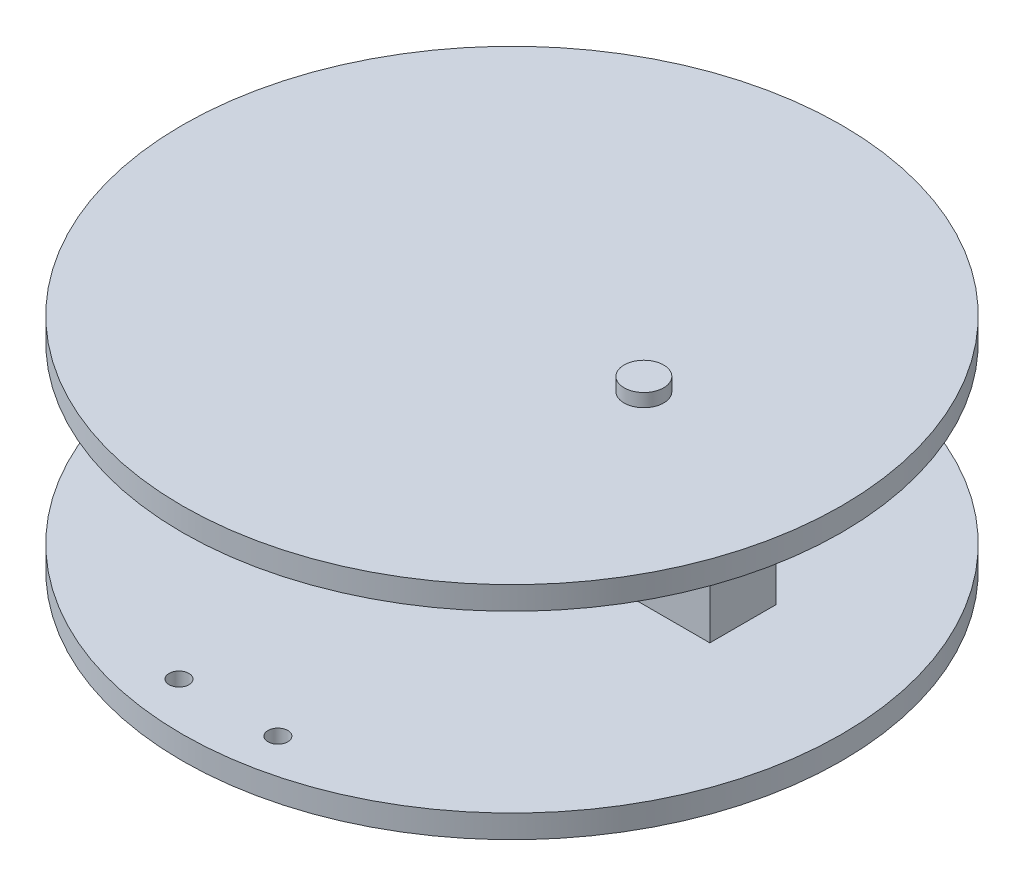
from build123d import *

# Parameters (mm, degrees)
SKETCH_1_R             = 50
EXTRUDE_1_DEPTH        = 3.5
PATTERN_LINEAR_3_COUNT = 2
PATTERN_LINEAR_3_PITCH = 30
EXTRUDE_START          = 10.5
SKETCH_2_W             = 70
SKETCH_2_H             = 10
EXTRUDE_2_DEPTH        = 10
SKETCH_3_R             = 3
EXTRUDE_3_DEPTH        = 2
SKETCH_5_R             = 1.5
CUT_EXTRUDE_1_DEPTH    = 78.614431648
SKETCH_6_R             = 3
EXTRUDE_4_DEPTH        = 3


with BuildPart() as part:
    # 草图1 → 凸台-拉伸1 (new body)
    with BuildSketch(Plane(origin=(0, 0, 0), x_dir=(1, 0, 0), z_dir=(0, 1, 0))):
        with Locations(Location((0, 0, 0), (0, 0, 270))):
            Circle(SKETCH_1_R)
    extrude(amount=EXTRUDE_1_DEPTH)


with BuildPart() as pattern_linear_3_1:
    # 阵列(线性)3: pattern copy
    add(part.part.moved(Location(Vector(0, 1, 0) * (1 * PATTERN_LINEAR_3_PITCH))))

    # 草图3 → 凸台-拉伸3 (add)
    with BuildSketch(Plane(origin=(0, 33.5, 0), x_dir=(1, 0, 0), z_dir=(0, 1, 0))):
        with Locations(Location((20, 0, 0), (0, 0, 270))):
            Circle(SKETCH_3_R)
    extrude(amount=EXTRUDE_3_DEPTH)


with BuildPart() as body_3:
    # 草图2 → 凸台-拉伸2 (new body)
    with BuildSketch(Plane(origin=(0, 0, 0), x_dir=(1, 0, 0), z_dir=(0, 1, 0)).offset(EXTRUDE_START)):
        Rectangle(SKETCH_2_W, SKETCH_2_H)
    extrude(amount=EXTRUDE_2_DEPTH)


with BuildPart() as part_1:
    add(part.part)

    # 草图5 → 切除-拉伸1 (cut, through all)
    with BuildSketch(Plane(origin=(0, 3.5, 0), x_dir=(1, 0, 0), z_dir=(0, 1, 0))):
        with Locations(Location((-7.5, -43, 0), (0, 0, 270))):
            Circle(SKETCH_5_R)
        with Locations(Location((7.5, -43, 0), (0, 0, 90))):
            Circle(SKETCH_5_R)
    extrude(amount=-CUT_EXTRUDE_1_DEPTH, mode=Mode.SUBTRACT)

    # 草图6 → 凸台-拉伸4 (add)
    with BuildSketch(Plane.XZ):
        with Locations(Location((0, -39, 0), (0, 0, 90))):
            Circle(SKETCH_6_R)
        with Locations(Location((-33.774990748, 19.5, 0), (0, 0, 90))):
            Circle(SKETCH_6_R)
        with Locations(Location((33.774990748, 19.5, 0), (0, 0, 90))):
            Circle(SKETCH_6_R)
    extrude(amount=EXTRUDE_4_DEPTH)


solid = Compound([pattern_linear_3_1.part, body_3.part, part_1.part])
